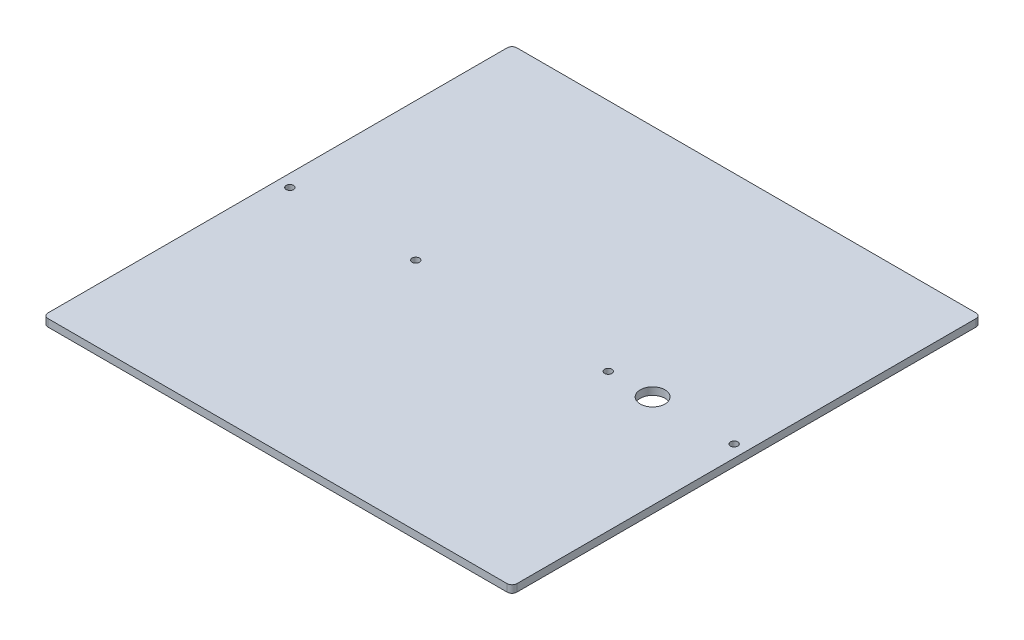
from build123d import *

# Parameters (mm, degrees)
SKETCH1_W           = 190
SKETCH1_H           = 190
SKETCH1_R           = 1.5
SKETCH1_R_2         = 5
BOSS_EXTRUDE1_DEPTH = 3
FILLET1_R           = 2


with BuildPart() as part:
    # Sketch1 → Boss-Extrude1 (new body)
    with BuildSketch(Plane(origin=(0, 0, 0), x_dir=(1, 0, 0), z_dir=(0, 1, 0))):
        with Locations((95, 95)):
            Rectangle(SKETCH1_W, SKETCH1_H)
        with Locations(Location((185, 95, 0), (0, 0, 270))):
            Circle(SKETCH1_R, mode=Mode.SUBTRACT)
        with Locations(Location((5, 95, 0), (0, 0, 270))):
            Circle(SKETCH1_R, mode=Mode.SUBTRACT)
        with Locations(Location((134, 95, 0), (0, 0, 270))):
            Circle(SKETCH1_R, mode=Mode.SUBTRACT)
        with Locations(Location((56, 95, 0), (0, 0, 270))):
            Circle(SKETCH1_R, mode=Mode.SUBTRACT)
        with Locations(Location((151.970083663, 95, 0), (0, 0, 270))):
            Circle(SKETCH1_R_2, mode=Mode.SUBTRACT)
    extrude(amount=BOSS_EXTRUDE1_DEPTH)

    # Fillet1
    fillet1_edges = [part.edges().sort_by_distance(p)[0] for p in [
        (190, 1.5, -190),
        (190, 1.5, 0),
        (0, 1.5, 0),
        (0, 1.5, -190),
    ]]
    fillet(fillet1_edges, radius=FILLET1_R)


solid = part.part
